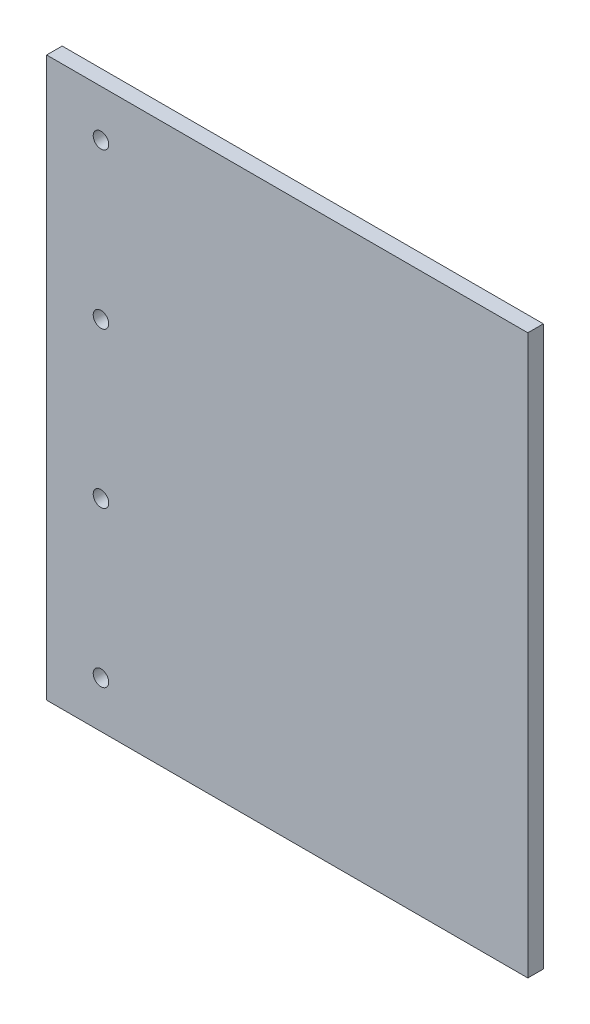
from build123d import *

# Parameters (mm, degrees)
SKETCH1_W                 = 393.7
SKETCH1_H                 = 457.2
PLATE_DEPTH               = 12.7
PATTERN_LINEAR_1110_COUNT = 4
PATTERN_LINEAR_1110_PITCH = 127


with BuildPart() as part:
    # Sketch1 → Plate (new body)
    with BuildSketch(Plane.XY):
        with Locations((196.85, 228.6)):
            Rectangle(SKETCH1_W, SKETCH1_H)
    extrude(amount=PLATE_DEPTH)

    # Sketch3 → Hole (revolve, cut)
    with BuildSketch(Plane(origin=(44.45, 38.1, 12.7), x_dir=(0, -1, 0), z_dir=(1, 0, 0))):
        Polygon((0, 0), (0, 29.215464931), (6.35, 25.4), (6.35, 0), align=None)
    hole = revolve(axis=Axis((44.45, 38.1, 19.05), (0, 0, -1)), mode=Mode.SUBTRACT)

    # Pattern Linear 1110: Hole ×4
    with Locations(*[(0, i * PATTERN_LINEAR_1110_PITCH, 0) for i in range(1, PATTERN_LINEAR_1110_COUNT)]):
        add(hole, mode=Mode.SUBTRACT)


solid = part.part
